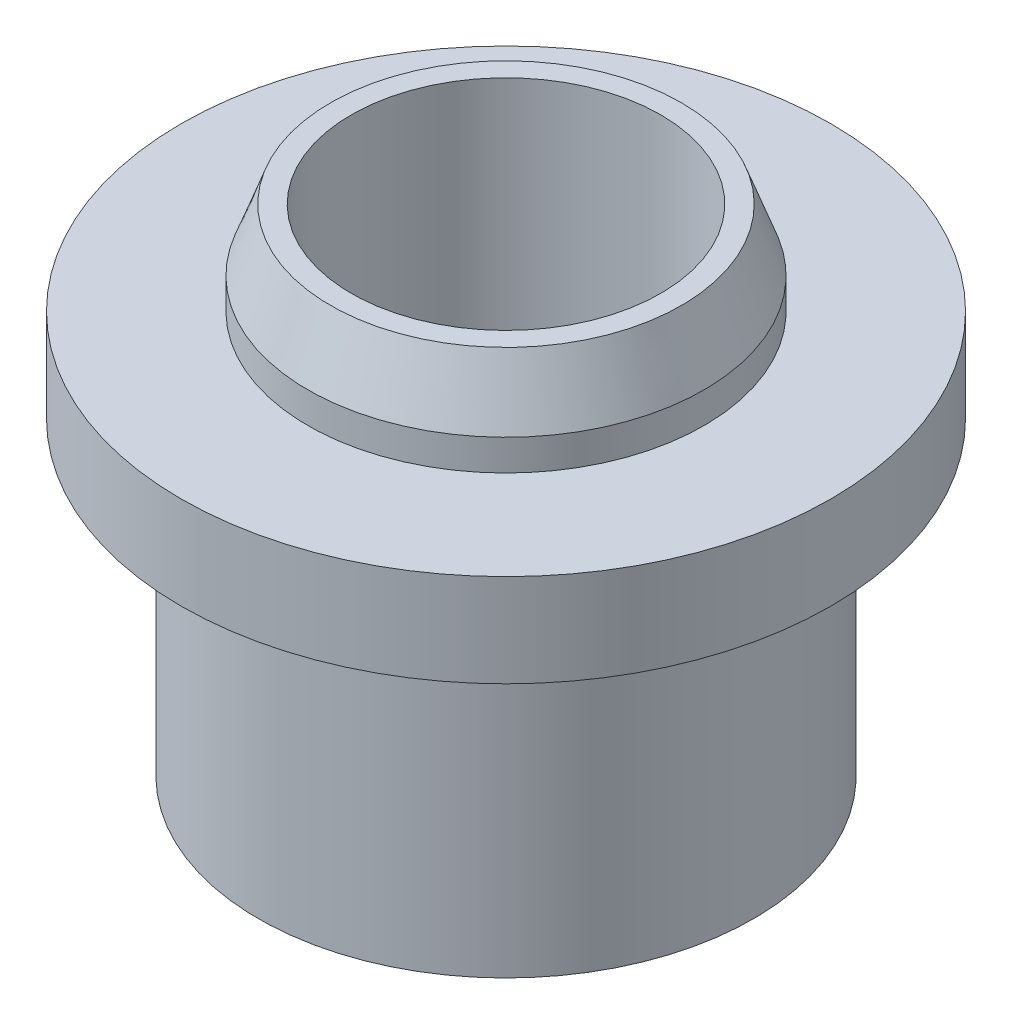
from build123d import *


with BuildPart() as part:
    # Sketch1 → Revolve1 (revolve)
    with BuildSketch(Plane.XY, mode=Mode.PRIVATE) as revolve1_sk:
        Polygon((2.5, -0.076264179), (2.5, 6.423735821), (2.5, 7.923735821), (2.836029766, 7.923735821), (3.2, 6.923735821), (3.2, 6.423735821), (5.25, 6.423735821), (5.25, 4.923735821), (4, 4.923735821), (4, -0.076264179), align=None)
    revolve(revolve1_sk.sketch.rotate(Axis((0, 0, 0), (0, 1, 0)), 90), axis=Axis((0, 0, 0), (0, 1, 0)))


solid = part.part
